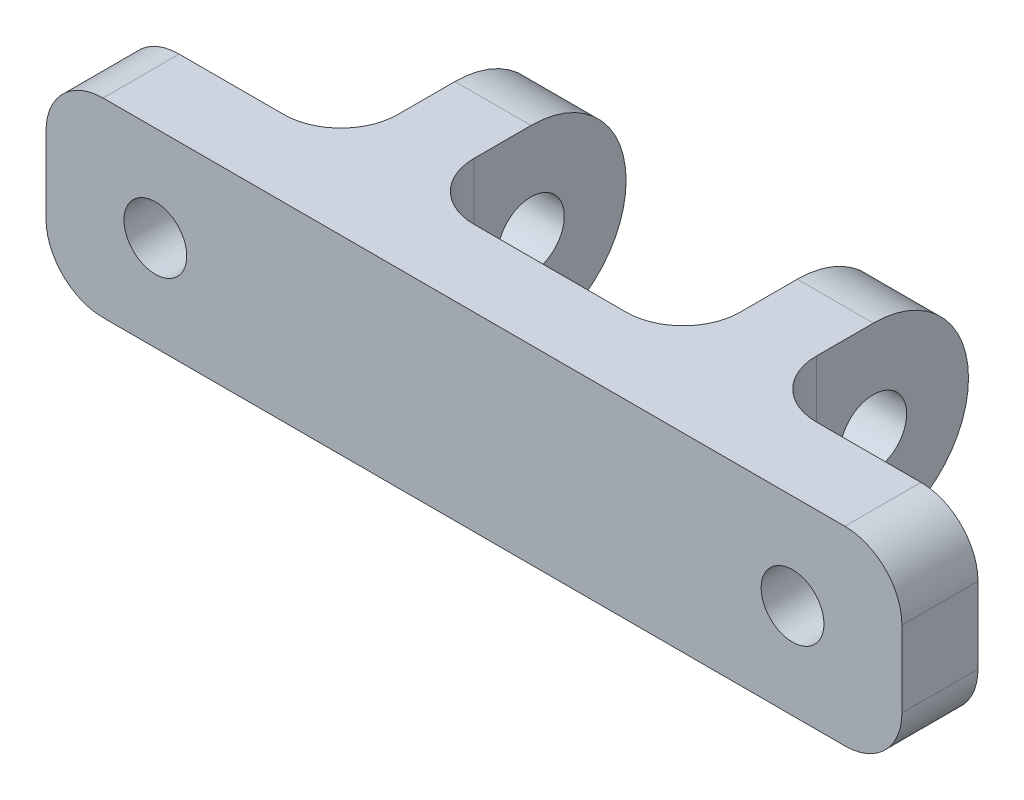
from build123d import *

# Parameters (mm, degrees)
BOSS_EXTRUDE1_DEPTH     = 10
CUT_EXTRUDE1_DEPTH      = 36.756118358
CUT_EXTRUDE1_DEPTH_BACK = 36.756118358
SKETCH2_R               = 1.75
SKETCH3_R               = 1.65
CUT_EXTRUDE2_DEPTH      = 27.96757312
FILLET1_R               = 3


with BuildPart() as part:
    # Sketch1 → Boss-Extrude1 (new body)
    with BuildSketch(Plane(origin=(0, 0, 0), x_dir=(1, 0, 0), z_dir=(0, 1, 0))):
        Polygon((-22.5, -7.5), (22.5, -7.5), (22.5, -3.5), (11, -3.5), (11, 7.5), (7, 7.5), (7, -3.5), (-7, -3.5), (-7, 7.5), (-11, 7.5), (-11, -3.5), (-22.5, -3.5), align=None)
    extrude(amount=BOSS_EXTRUDE1_DEPTH)

    # Sketch2 → Cut-Extrude1 (cut, two sides: drawn at the far end of the back side and taken through both)
    with BuildSketch(Plane.ZY.offset(11).offset(-CUT_EXTRUDE1_DEPTH_BACK)):
        with BuildLine():
            Line((-7.5, 10), (-7.5, 5))
            ThreePointArc((-7.5, 5), (-6.035533906, 8.535533906), (-2.5, 10))
            Line((-2.5, 10), (-7.5, 10))
        make_face()
        with BuildLine():
            Line((-7.5, 0), (-2.5, 0))
            ThreePointArc((-2.5, 0), (-6.035533906, 1.464466094), (-7.5, 5))
            Line((-7.5, 5), (-7.5, 0))
        make_face()
        with Locations((-2.5, 5)):
            Circle(SKETCH2_R)
    extrude(amount=CUT_EXTRUDE1_DEPTH + CUT_EXTRUDE1_DEPTH_BACK, mode=Mode.SUBTRACT)

    # Sketch3 → Cut-Extrude2 (cut, through all)
    with BuildSketch(Plane(origin=(0, 0, 3.5), x_dir=(-1, 0, 0), z_dir=(0, 0, -1))):
        with Locations((16.75, 5)):
            Circle(SKETCH3_R)
        with Locations(Location((-16.75, 5, 0), (0, 0, 180))):
            Circle(SKETCH3_R)
    extrude(amount=-CUT_EXTRUDE2_DEPTH, mode=Mode.SUBTRACT)

    # Fillet1
    fillet1_edges = [part.edges().sort_by_distance(p)[0] for p in [
        (22.5, 0, 5.5),
        (-22.5, 0, 5.5),
        (-11, 5, 3.5),
        (-7, 5, 3.5),
        (7, 5, 3.5),
        (11, 5, 3.5),
        (-22.5, 10, 5.5),
        (22.5, 10, 5.5),
    ]]
    fillet(fillet1_edges, radius=FILLET1_R)


solid = part.part
